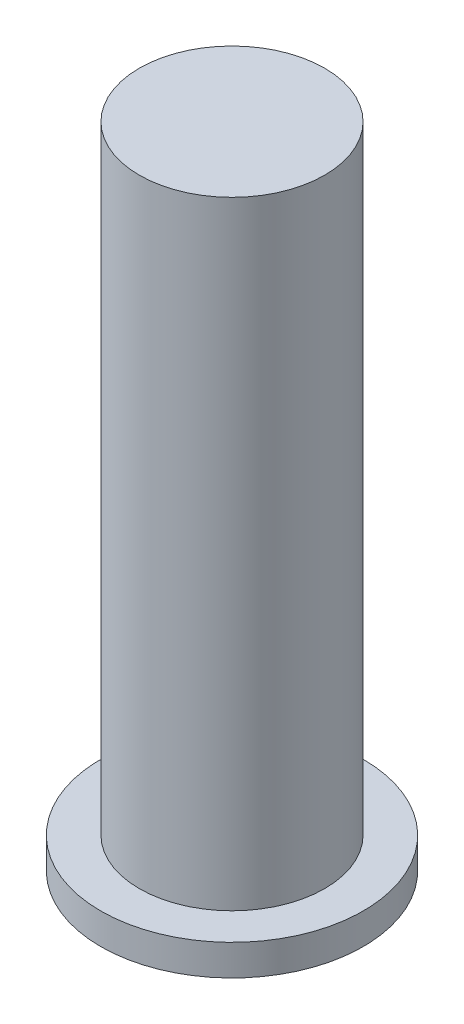
from build123d import *

# Parameters (mm, degrees)
MAIN_PROFILE_SKETCH_R     = 8.5
MAIN_EXTRUSION_DEPTH      = 2
DETAIL_EXTRUSION_2_DEPTH  = 31.5
DETAIL_EXTRUSION_3_DEPTH  = 0.5
DETAIL_PROFILE_4_SKETCH_R = 6
DETAIL_EXTRUSION_4_DEPTH  = 8


with BuildPart() as part:
    # Main Profile Sketch → Main Extrusion (new body)
    with BuildSketch(Plane(origin=(0, -123, 0), x_dir=(-1, 0, 0), z_dir=(0, -1, 0))):
        with Locations(Location((56.291651246, 0, 0), (0, 0, 90))):
            Circle(MAIN_PROFILE_SKETCH_R)
    extrude(amount=MAIN_EXTRUSION_DEPTH)

    # Detail Profile 2 Sketch → Detail Extrusion 2 (add)
    with BuildSketch(Plane(origin=(0, -125, 0), x_dir=(-1, 0, 0), z_dir=(0, -1, 0))):
        with BuildLine():
            ThreePointArc((51.384442087, -3.452433674), (62.011933361, 1.81062766), (50.291651246, 0))
            ThreePointArc((50.291651246, 0), (50.571369131, -1.81062766), (51.384442087, -3.452433674))
        make_face()
    extrude(amount=DETAIL_EXTRUSION_2_DEPTH)

    # Detail Profile 3 Sketch → Detail Extrusion 3 (add)
    with BuildSketch(Plane(origin=(0, -156.5, 0), x_dir=(-1, 0, 0), z_dir=(0, -1, 0))):
        with BuildLine():
            ThreePointArc((51.384442087, -3.452433674), (62.011933361, 1.81062766), (50.291651246, 0))
            ThreePointArc((50.291651246, 0), (50.571369131, -1.81062766), (51.384442087, -3.452433674))
        make_face()
    extrude(amount=DETAIL_EXTRUSION_3_DEPTH)

    # Detail Profile 4 Sketch → Detail Extrusion 4 (add)
    with BuildSketch(Plane(origin=(0, -157, 0), x_dir=(-1, 0, 0), z_dir=(0, -1, 0))):
        with Locations(Location((56.291651246, 0, 0), (0, 0, 90))):
            Circle(DETAIL_PROFILE_4_SKETCH_R)
    extrude(amount=DETAIL_EXTRUSION_4_DEPTH)


with BuildPart() as body_2:
    # Mirror1: mirrored copy
    add(part.part.mirror(Plane(origin=(0, 0, 0), x_dir=(0, 0, 1), z_dir=(0, -1, 0))))


solid = body_2.part
